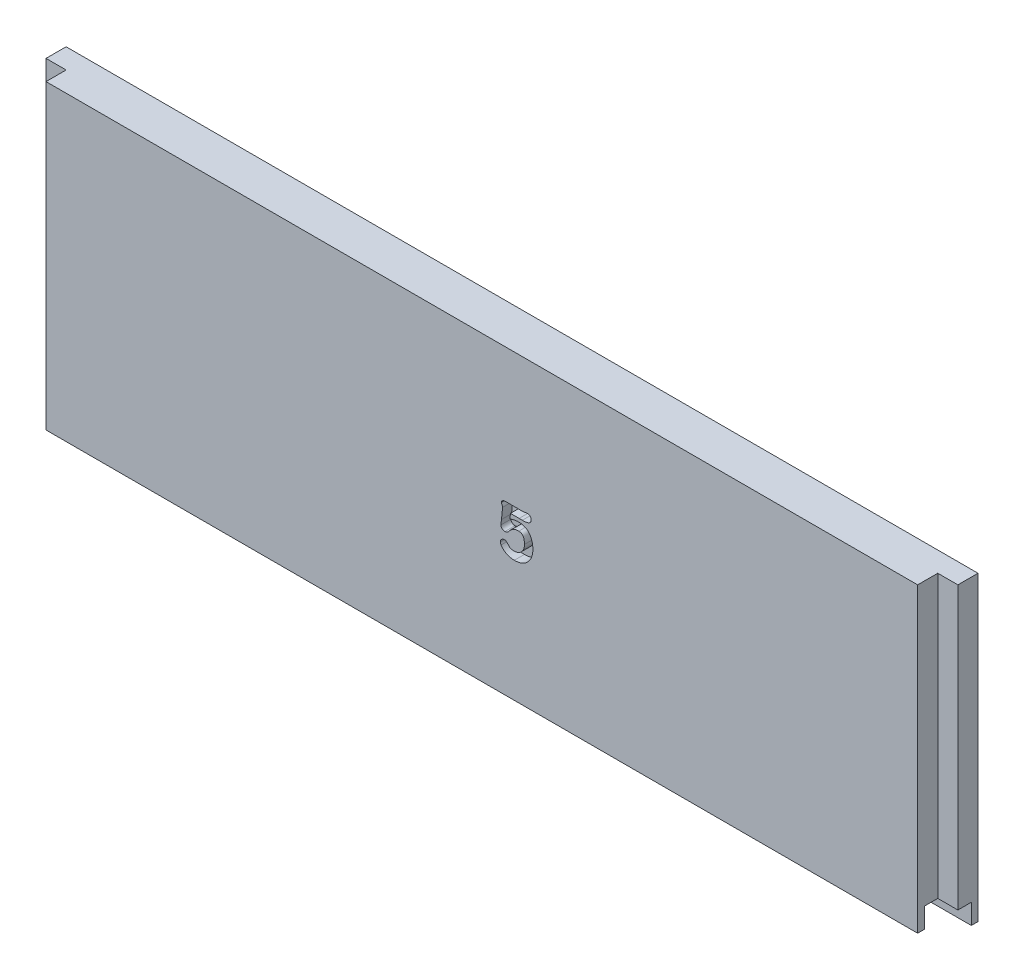
from build123d import *

# Parameters (mm, degrees)
SKETCH_1_W           = 130
SKETCH_1_H           = 45
EXTRUDE_1_DEPTH      = 6
EXTRUDE_2_DEPTH      = 3
EXTRUDE_2_DEPTH_BACK = 133
SKETCH_2_W           = 3
SKETCH_2_H           = 45
SKETCH_3_W           = 130
SKETCH_3_H           = 2
CUT_EXTRUDE_1_DEPTH  = 3
CUT_EXTRUDE_2_DEPTH  = 1.5


with BuildPart() as part:
    # 草圖1 → 填料-伸長1 (new body)
    with BuildSketch(Plane.XY):
        with Locations((12.963666087, -49.077380952)):
            Rectangle(SKETCH_1_W, SKETCH_1_H)
    extrude(amount=EXTRUDE_1_DEPTH)

    # 草圖2 → 填料-伸長2 (add, two sides: drawn at the far end of the back side and taken through both)
    with BuildSketch(Plane.ZY.offset(52.036333913).offset(-EXTRUDE_2_DEPTH_BACK)):
        with Locations((1.5, -49.077380952)):
            Rectangle(SKETCH_2_W, SKETCH_2_H)
    extrude(amount=EXTRUDE_2_DEPTH + EXTRUDE_2_DEPTH_BACK)

    # 草圖3 → 除料-伸長1 (cut)
    with BuildSketch(Plane.XZ.offset(71.577380952)):
        with Locations((12.963666087, 4)):
            Rectangle(SKETCH_3_W, SKETCH_3_H)
        Polygon((-55.036333913, 3), (-55.036333913, 1), (80.963666087, 1), (80.963666087, 3), (77.963666087, 3), (-52.036333913, 3), align=None)
    extrude(amount=-CUT_EXTRUDE_1_DEPTH, mode=Mode.SUBTRACT)

    # 草圖4 → 除料-伸長2 (cut)
    with BuildSketch(Plane.XY.offset(6)):
        with BuildLine():
            add(Edge.make_bspline(
                [(17.812230687, -53.479637062), (17.757344739, -53.478913378), (17.649185943, -53.47748728), (17.489619933, -53.465340676), (17.33560047, -53.446284645), (17.187167874, -53.417966115), (17.043565484, -53.385272311), (16.906281053, -53.341704907), (16.774643917, -53.290335845), (16.648602144, -53.231810969), (16.526874371, -53.166169268), (16.411684878, -53.091718804), (16.300573628, -53.011035217), (16.198060032, -52.919482624), (16.098053508, -52.823666813), (16.004960938, -52.71812525), (15.917706487, -52.604767433), (15.864143823, -52.524635549), (15.837157445, -52.484262848)],
                knots=[0, 0, 0, 0, 1.136959265, 2.24050327, 3.313538964, 4.350357384, 5.370001804, 6.362877957, 7.331147751, 8.295754707, 9.240328319, 10.193734322, 11.135547026, 12.081756115, 13.038655239, 14.003557421, 14.994136006, 16, 16, 16, 16], degree=3))
            add(Edge.make_bspline(
                [(15.837157445, -52.484262848), (15.82023133, -52.455933915), (15.787851968, -52.401741161), (15.753905612, -52.316706915), (15.731057953, -52.233796365), (15.728622223, -52.178301907), (15.727431154, -52.151165179)],
                knots=[0, 0, 0, 0, 1.112928258, 2.129012325, 3.085089127, 4, 4, 4, 4], degree=3))
            add(Edge.make_bspline(
                [(15.727431154, -52.151165179), (15.729544004, -52.11124705), (15.733695507, -52.032812635), (15.771137286, -51.92076337), (15.82965467, -51.817786457), (15.910678736, -51.727723194), (16.00584136, -51.653429284), (16.109426189, -51.596438929), (16.220846417, -51.562519183), (16.297611111, -51.558721208), (16.336150817, -51.556814435)],
                knots=[0, 0, 0, 0, 1.015359854, 1.995062352, 2.979785778, 4.01807891, 5.06205617, 6.045714794, 7.018851354, 8, 8, 8, 8], degree=3))
            add(Edge.make_bspline(
                [(16.336150817, -51.556814435), (16.375657152, -51.558850839), (16.453423593, -51.562859411), (16.564661868, -51.601743834), (16.666466818, -51.664190183), (16.722631799, -51.721795265), (16.751543205, -51.751447975)],
                knots=[0, 0, 0, 0, 0.99888911, 1.966268167, 2.953119069, 4, 4, 4, 4], degree=3))
            add(Edge.make_bspline(
                [(16.751543205, -51.751447975), (16.775076259, -51.777990218), (16.819479561, -51.828071405), (16.881571729, -51.898724037), (16.93656475, -51.957909845), (16.981308226, -52.008469847), (17.017876515, -52.048974575), (17.046245631, -52.079824523), (17.065619754, -52.100944998), (17.075912949, -52.111125302), (17.079415813, -52.114589748)],
                knots=[0, 0, 0, 0, 1.739958547, 3.283037843, 4.613396854, 5.70242641, 6.594602764, 7.289956713, 7.758366037, 8, 8, 8, 8], degree=3))
            add(Edge.make_bspline(
                [(17.079415813, -52.114589748), (17.125006797, -52.144790299), (17.219228807, -52.207205195), (17.38693282, -52.266895894), (17.577186268, -52.303839501), (17.712318599, -52.307365921), (17.783492849, -52.309223289)],
                knots=[0, 0, 0, 0, 0.880598761, 1.819916513, 2.851749203, 4, 4, 4, 4], degree=3))
            add(Edge.make_bspline(
                [(17.783492849, -52.309223289), (17.838020123, -52.307832456), (17.944987472, -52.305104029), (18.101926321, -52.280138984), (18.25242025, -52.243188474), (18.395805683, -52.189266935), (18.531709488, -52.118927509), (18.6607769, -52.033961968), (18.783863945, -51.934164823), (18.857600906, -51.857222466), (18.89512468, -51.818067509)],
                knots=[0, 0, 0, 0, 1.043544114, 2.047143341, 3.036120758, 4.007218486, 4.973146945, 5.960717165, 6.962235672, 8, 8, 8, 8], degree=3))
            add(Edge.make_bspline(
                [(18.89512468, -51.818067509), (18.929551044, -51.778270353), (18.997666157, -51.699528728), (19.083260541, -51.570258781), (19.157381424, -51.43643278), (19.217610301, -51.295918584), (19.26470192, -51.148944864), (19.298905349, -50.995563073), (19.318535755, -50.835835625), (19.321016993, -50.72738876), (19.322273457, -50.672472778)],
                knots=[0, 0, 0, 0, 1.008012047, 1.994426572, 2.965889163, 3.938248186, 4.920413956, 5.921034844, 6.947240987, 8, 8, 8, 8], degree=3))
            add(Edge.make_bspline(
                [(19.322273457, -50.672472778), (19.321295131, -50.620217561), (19.319402206, -50.519110908), (19.311309881, -50.372453225), (19.29328876, -50.236207602), (19.272682432, -50.109655141), (19.2419518, -49.99368528), (19.205542296, -49.88747888), (19.163226374, -49.790751632), (19.11278258, -49.704734529), (19.056792524, -49.628538048), (18.993706781, -49.561852018), (18.922254588, -49.507700173), (18.84627241, -49.45997592), (18.76105109, -49.427530617), (18.671075953, -49.400027183), (18.573312153, -49.386492108), (18.506322634, -49.384310203), (18.4718947, -49.383188856)],
                knots=[0, 0, 0, 0, 1.432194387, 2.771099032, 4.021603008, 5.196571272, 6.281788198, 7.304329707, 8.271053509, 9.169388415, 10.030836102, 10.857799991, 11.674021384, 12.482268335, 13.306473372, 14.163613793, 15.05622575, 16, 16, 16, 16], degree=3))
            add(Edge.make_bspline(
                [(18.4718947, -49.383188856), (18.410424152, -49.384683513), (18.290551861, -49.387598209), (18.115312089, -49.410669876), (17.949155366, -49.446213986), (17.792005065, -49.49915373), (17.644744555, -49.567149164), (17.505945869, -49.64867221), (17.376587516, -49.74554675), (17.29976884, -49.821586712), (17.2609867, -49.859975717)],
                knots=[0, 0, 0, 0, 1.101333317, 2.147684583, 3.162570299, 4.142282915, 5.113003141, 6.06458838, 7.022901616, 8, 8, 8, 8], degree=3))
            add(Edge.make_bspline(
                [(17.2609867, -49.859975717), (17.201016282, -49.926267541), (17.080681188, -50.059287005), (16.95892332, -50.191005411), (16.897844927, -50.25708039)],
                knots=[0, 0, 0, 0, 0.996723672, 2, 2, 2, 2], degree=3))
            add(Edge.make_bspline(
                [(16.897844927, -50.25708039), (16.859249562, -50.289476145), (16.784893459, -50.35188836), (16.660163983, -50.418646351), (16.532011272, -50.462972726), (16.444053302, -50.46766164), (16.40015782, -50.470001645)],
                knots=[0, 0, 0, 0, 1.089532957, 2.099045497, 3.051327429, 4, 4, 4, 4], degree=3))
            add(Edge.make_bspline(
                [(16.40015782, -50.470001645), (16.360275692, -50.468205114), (16.282672837, -50.464709414), (16.17175323, -50.431052491), (16.068843048, -50.380523103), (15.980659054, -50.306644762), (15.905226306, -50.221493813), (15.851792803, -50.125004735), (15.816122975, -50.021354225), (15.812752346, -49.949100966), (15.811032137, -49.912226331)],
                knots=[0, 0, 0, 0, 1.060372781, 2.06327896, 3.065177024, 4.096694214, 5.108961053, 6.080822624, 7.020542948, 8, 8, 8, 8], degree=3))
            add(Edge.make_bspline(
                [(15.811032137, -49.912226331), (15.811393269, -49.901336703), (15.81231898, -49.873422682), (15.816618867, -49.823349976), (15.823211421, -49.756299897), (15.83265205, -49.672292309), (15.84375588, -49.571136628), (15.860667648, -49.452967528), (15.8766943, -49.317809178), (15.88929414, -49.222068294), (15.895939387, -49.171573866)],
                knots=[0, 0, 0, 0, 0.350634574, 0.898802078, 1.616951692, 2.519207815, 3.619566083, 4.892003884, 6.360820583, 8, 8, 8, 8], degree=3))
            add(Edge.make_bspline(
                [(15.895939387, -49.171573866), (15.909090575, -49.071874447), (15.934234423, -48.881258439), (15.968763171, -48.608791182), (15.99560468, -48.362166452), (16.01963553, -48.141939173), (16.038061915, -47.947292948), (16.051229704, -47.778774663), (16.059863838, -47.636365497), (16.061224088, -47.55007211), (16.061835089, -47.511310578)],
                knots=[0, 0, 0, 0, 1.445824804, 2.764282433, 3.948511196, 5.012461347, 5.949332829, 6.759315622, 7.442705535, 8, 8, 8, 8], degree=3))
            add(Edge.make_bspline(
                [(16.061835089, -47.511310578), (16.060647193, -47.492506153), (16.058044905, -47.451311869), (16.040717164, -47.385732016), (16.014228022, -47.310749314), (15.978234105, -47.230463523), (15.942240188, -47.150177732), (15.915751045, -47.07519503), (15.898423305, -47.009615177), (15.895821017, -46.968420893), (15.894633121, -46.949616468)],
                knots=[0, 0, 0, 0, 0.765069692, 1.676015005, 2.746174507, 4, 5.253825493, 6.323984995, 7.234930308, 8, 8, 8, 8], degree=3))
            add(Edge.make_bspline(
                [(15.894633121, -46.949616468), (15.897375111, -46.91563509), (15.902719574, -46.849401348), (15.946126554, -46.756992827), (16.018895145, -46.679961906), (16.081977279, -46.644465271), (16.115391969, -46.625662656)],
                knots=[0, 0, 0, 0, 0.981153879, 1.912385446, 2.894187808, 4, 4, 4, 4], degree=3))
            add(Edge.make_bspline(
                [(16.115391969, -46.625662656), (16.145179683, -46.612781919), (16.206123105, -46.5864289), (16.304355627, -46.559327625), (16.410090545, -46.543554958), (16.48283158, -46.541707757), (16.520334234, -46.540755407)],
                knots=[0, 0, 0, 0, 0.932741244, 1.90831837, 2.92160439, 4, 4, 4, 4], degree=3))
            add(Edge.make_bspline(
                [(16.520334234, -46.540755407), (16.536444841, -46.540755407), (16.572584849, -46.540755407), (16.632237634, -46.540755407), (16.703211386, -46.540755407), (16.781587309, -46.540755407), (16.859963231, -46.540755407), (16.930936983, -46.540755407), (16.990589768, -46.540755407), (17.026729777, -46.540755407), (17.042840383, -46.540755407)],
                knots=[0, 0, 0, 0, 0.74, 1.66, 2.74, 4, 5.26, 6.34, 7.26, 8, 8, 8, 8], degree=3))
            Line((17.042840383, -46.540755407), (19.12110859, -46.540755407))
            add(Edge.make_bspline(
                [(19.12110859, -46.540755407), (19.137668451, -46.540066037), (19.178305409, -46.538374363), (19.250131883, -46.529535283), (19.344191291, -46.516519292), (19.452902526, -46.498972789), (19.562025353, -46.481256816), (19.656975117, -46.468365566), (19.730540217, -46.459447264), (19.772484933, -46.457827549), (19.78991646, -46.457154423)],
                knots=[0, 0, 0, 0, 0.5896073, 1.446862712, 2.573177991, 3.969148823, 5.365119654, 6.506784141, 7.379444323, 8, 8, 8, 8], degree=3))
            add(Edge.make_bspline(
                [(19.78991646, -46.457154423), (19.827609753, -46.45903753), (19.900373685, -46.46267272), (20.003816553, -46.494481069), (20.097554473, -46.544058175), (20.176246351, -46.616395158), (20.24412065, -46.700308721), (20.291196572, -46.799728287), (20.321186987, -46.909985616), (20.324018594, -46.987725809), (20.325485262, -47.02799239)],
                knots=[0, 0, 0, 0, 1.029924964, 1.988189005, 2.937957498, 3.909411138, 4.894599592, 5.87588343, 6.899785187, 8, 8, 8, 8], degree=3))
            add(Edge.make_bspline(
                [(20.325485262, -47.02799239), (20.324525883, -47.05593089), (20.322651061, -47.110528426), (20.306670852, -47.189825936), (20.279982063, -47.263303507), (20.245348176, -47.33276558), (20.196301836, -47.393927343), (20.140569206, -47.452823481), (20.071468568, -47.502929483), (19.99343221, -47.548781511), (19.906266402, -47.591359828), (19.80689456, -47.623955083), (19.698535491, -47.6543799), (19.579869062, -47.679136826), (19.450571201, -47.696531261), (19.311258479, -47.711555404), (19.161244165, -47.718776056), (19.057977661, -47.719790926), (19.004850971, -47.720313037)],
                knots=[0, 0, 0, 0, 0.805244239, 1.573611751, 2.320330751, 3.056093804, 3.799532367, 4.572095564, 5.388329092, 6.249773062, 7.182157615, 8.178952529, 9.260497266, 10.427866396, 11.670989424, 13.021716959, 14.467786609, 16, 16, 16, 16], degree=3))
            add(Edge.make_bspline(
                [(19.004850971, -47.720313037), (18.965664284, -47.719860727), (18.877707176, -47.718845485), (18.765763809, -47.717878473), (18.673080162, -47.71347485), (18.613832862, -47.712902273), (18.567697649, -47.710911832), (18.541563344, -47.711093502), (18.530676642, -47.71116918)],
                knots=[0, 0, 0, 0, 1.487347207, 3.338448998, 4.247928013, 5.008260374, 5.586873499, 6, 6, 6, 6], degree=3))
            Line((18.530676642, -47.71116918), (17.232248862, -47.71116918))
            add(Edge.make_bspline(
                [(17.232248862, -47.71116918), (17.230967904, -47.731635316), (17.228214171, -47.775632273), (17.223168966, -47.847101164), (17.214778108, -47.928875362), (17.206203513, -48.021725508), (17.193780553, -48.124803581), (17.181195423, -48.2389911), (17.165175671, -48.363429538), (17.15428511, -48.450077313), (17.148647878, -48.494928403)],
                knots=[0, 0, 0, 0, 0.624278521, 1.342039105, 2.180917254, 3.126624057, 4.18058585, 5.341411487, 6.62384703, 8, 8, 8, 8], degree=3))
            add(Edge.make_bspline(
                [(17.148647878, -48.494928403), (17.197113788, -48.472024318), (17.294807648, -48.425856023), (17.448660893, -48.368688198), (17.609252768, -48.320371229), (17.776955366, -48.281675562), (17.950795308, -48.249935527), (18.131802875, -48.228011965), (18.319726857, -48.21465837), (18.447488386, -48.213409491), (18.512388926, -48.212775083)],
                knots=[0, 0, 0, 0, 0.915367454, 1.845127417, 2.800508147, 3.778382277, 4.783624371, 5.817838469, 6.891501507, 8, 8, 8, 8], degree=3))
            add(Edge.make_bspline(
                [(18.512388926, -48.212775083), (18.59785104, -48.21542158), (18.764791629, -48.220591213), (19.007489918, -48.256823278), (19.23414897, -48.319966032), (19.444844073, -48.407375347), (19.638913223, -48.521520883), (19.818022469, -48.659195471), (19.979943, -48.823822154), (20.072222999, -48.948752745), (20.119095334, -49.01220949)],
                knots=[0, 0, 0, 0, 1.094932711, 2.138827415, 3.135105282, 4.10287208, 5.053046373, 6.011635225, 6.990037934, 8, 8, 8, 8], degree=3))
            add(Edge.make_bspline(
                [(20.119095334, -49.01220949), (20.155844356, -49.068187812), (20.229699228, -49.180687998), (20.322355846, -49.362507179), (20.399935948, -49.554797484), (20.466499292, -49.75685717), (20.515381877, -49.970387985), (20.549933193, -50.19437281), (20.573464167, -50.428572879), (20.575334525, -50.588376809), (20.576288214, -50.669860247)],
                knots=[0, 0, 0, 0, 0.919716147, 1.848362634, 2.7984311, 3.767289499, 4.768803224, 5.804709504, 6.88062942, 8, 8, 8, 8], degree=3))
            add(Edge.make_bspline(
                [(20.576288214, -50.669860247), (20.574007735, -50.767929628), (20.56953401, -50.960317059), (20.535044183, -51.242324885), (20.478079233, -51.51145306), (20.396108927, -51.767397461), (20.293801407, -52.011534967), (20.164967555, -52.240995056), (20.017361244, -52.45998874), (19.899908428, -52.591753441), (19.840860809, -52.657996143)],
                knots=[0, 0, 0, 0, 1.083138383, 2.124844756, 3.133372969, 4.117611956, 5.08964535, 6.052074486, 7.020710048, 8, 8, 8, 8], degree=3))
            add(Edge.make_bspline(
                [(19.840860809, -52.657996143), (19.775555875, -52.723436311), (19.64621902, -52.853040998), (19.429960698, -53.021411272), (19.197502504, -53.16247124), (18.950518876, -53.279938364), (18.687539485, -53.370179005), (18.409506615, -53.433710245), (18.115932502, -53.472301488), (17.915110095, -53.477152126), (17.812230687, -53.479637062)],
                knots=[0, 0, 0, 0, 0.983535996, 1.947899545, 2.909060314, 3.873256734, 4.853981293, 5.862616727, 6.905038893, 8, 8, 8, 8], degree=3))
        make_face()
    extrude(amount=-CUT_EXTRUDE_2_DEPTH, mode=Mode.SUBTRACT)


solid = part.part
